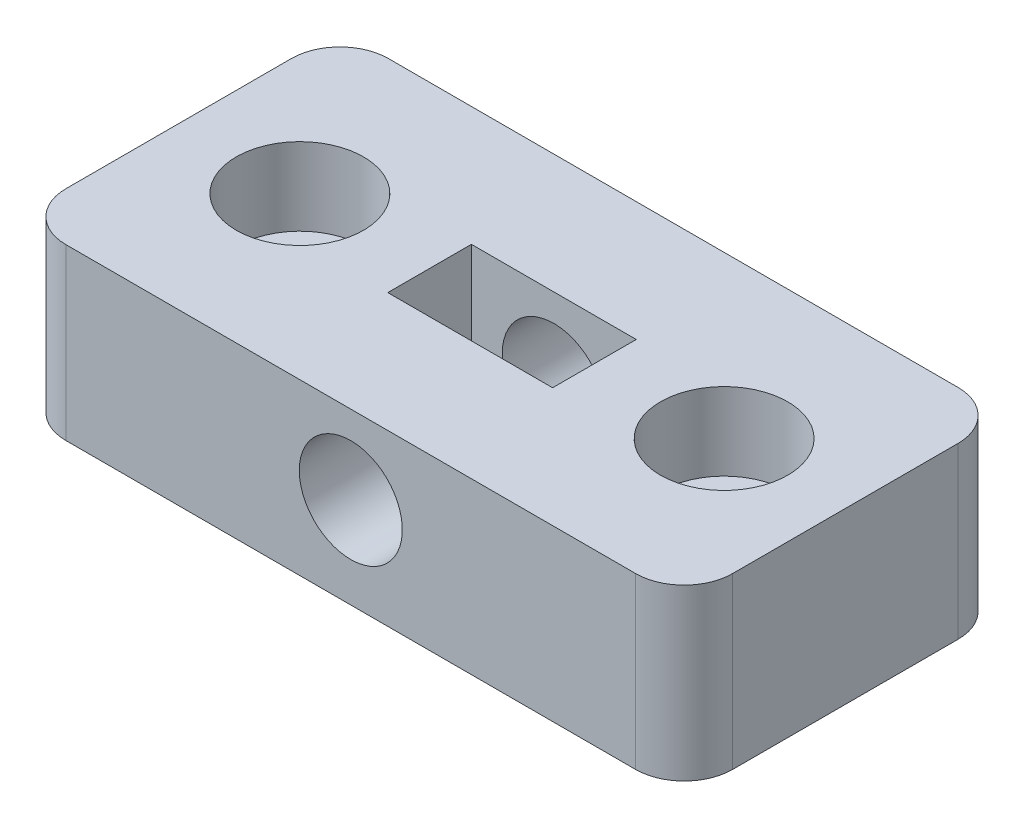
from build123d import *

# Parameters (mm, degrees)
SKETCH1_W           = 55
SKETCH1_H           = 26.6
SKETCH1_R           = 3.25
BOSS_EXTRUDE1_DEPTH = 14
SKETCH3_W           = 13.6
SKETCH3_H           = 6.9
CUT_EXTRUDE1_DEPTH  = 13
SKETCH4_R           = 4.25
CUT_EXTRUDE2_DEPTH  = 41.740765825
SKETCH5_R           = 5.25
CUT_EXTRUDE3_DEPTH  = 6.4
FILLET1_R           = 4


with BuildPart() as part:
    # Sketch1 → Boss-Extrude1 (new body)
    with BuildSketch(Plane(origin=(0, 0, 0), x_dir=(1, 0, 0), z_dir=(0, 1, 0))):
        Rectangle(SKETCH1_W, SKETCH1_H)
        with Locations(Location((-17.5, 0, 0), (0, 0, 270))):
            Circle(SKETCH1_R, mode=Mode.SUBTRACT)
        with Locations(Location((17.5, 0, 0), (0, 0, 90))):
            Circle(SKETCH1_R, mode=Mode.SUBTRACT)
    extrude(amount=BOSS_EXTRUDE1_DEPTH)

    # Sketch3 → Cut-Extrude1 (cut)
    with BuildSketch(Plane(origin=(0, 14, 0), x_dir=(1, 0, 0), z_dir=(0, 1, 0))):
        Rectangle(SKETCH3_W, SKETCH3_H)
    extrude(amount=-CUT_EXTRUDE1_DEPTH, mode=Mode.SUBTRACT)

    # Sketch4 → Cut-Extrude2 (cut, through all)
    with BuildSketch(Plane(origin=(0, 0, -13.3), x_dir=(-1, 0, 0), z_dir=(0, 0, -1))):
        with Locations((0, 7.5)):
            Circle(SKETCH4_R)
    extrude(amount=-CUT_EXTRUDE2_DEPTH, mode=Mode.SUBTRACT)

    # Sketch5 → Cut-Extrude3 (cut)
    with BuildSketch(Plane(origin=(0, 14, 0), x_dir=(1, 0, 0), z_dir=(0, 1, 0))):
        with Locations(Location((-17.5, 0, 0), (0, 0, 270))):
            Circle(SKETCH5_R)
        with Locations(Location((17.5, 0, 0), (0, 0, 270))):
            Circle(SKETCH5_R)
    extrude(amount=-CUT_EXTRUDE3_DEPTH, mode=Mode.SUBTRACT)

    # Fillet1
    fillet1_edges = [part.edges().sort_by_distance(p)[0] for p in [
        (27.5, 7, 13.3),
        (-27.5, 7, 13.3),
        (-27.5, 7, -13.3),
        (27.5, 7, -13.3),
    ]]
    fillet(fillet1_edges, radius=FILLET1_R)


solid = part.part
